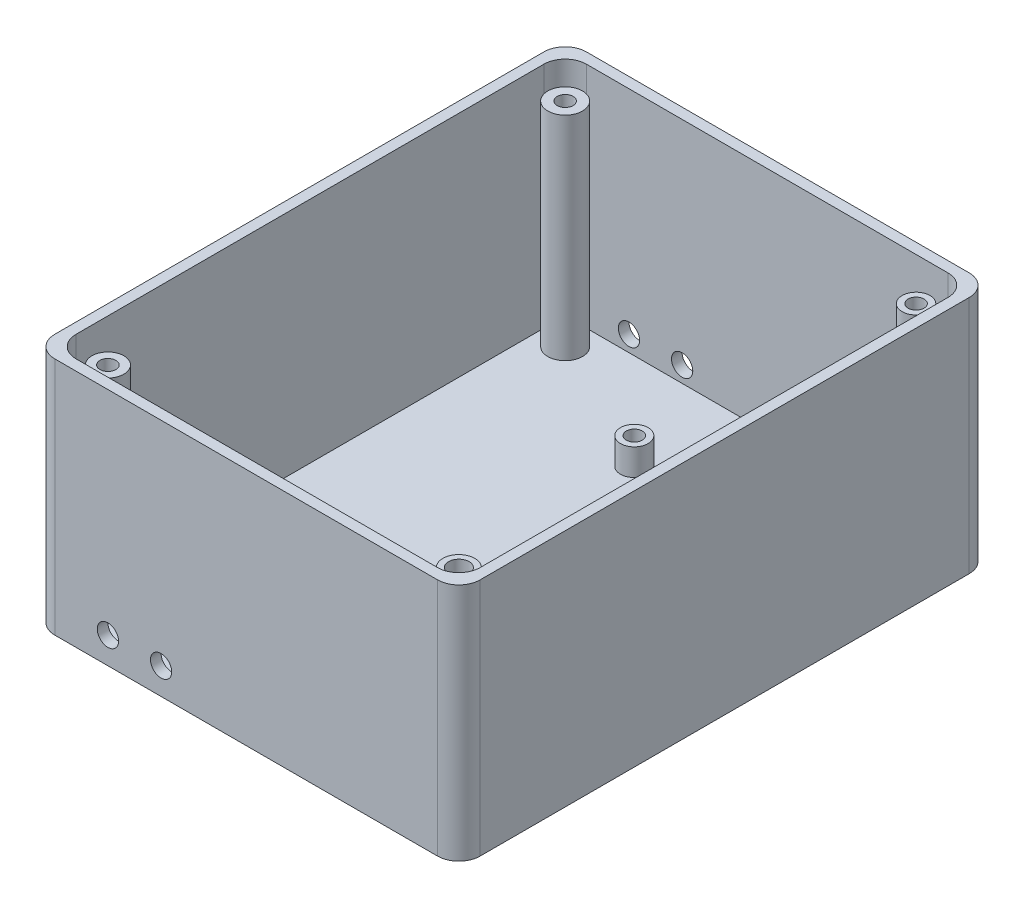
from build123d import *

# Parameters (mm, degrees)
SKETCH1_W            = 80
SKETCH1_H            = 100
BOSS_EXTRUDE1_DEPTH  = 45
SHELL1_T             = -2
FILLET1_R            = 4
FILLET2_R            = 4
FILLET4_R            = 4
FILLET5_R            = 4
FILLET6_R            = 4
FILLET7_R            = 4
FILLET12_R           = 4
FILLET13_R           = 4
SKETCH33_R           = 2.6
BOSS_EXTRUDE9_DEPTH  = 5
SKETCH37_R           = 2.624374832
SKETCH37_R_2         = 3
SKETCH37_R_3         = 3.264262679
BOSS_EXTRUDE10_DEPTH = 40
SKETCH38_R           = 1.5
SKETCH38_R_2         = 1.938271083
CUT_EXTRUDE3_DEPTH   = 40
SKETCH39_R           = 1.5
CUT_EXTRUDE4_DEPTH   = 5
SKETCH40_R           = 2
CUT_EXTRUDE5_DEPTH   = 10
CUT_EXTRUDE6_START   = -10
SKETCH41_R           = 2
CUT_EXTRUDE6_DEPTH   = 10


with BuildPart() as part:
    # Sketch1 → Boss-Extrude1 (new body)
    with BuildSketch(Plane(origin=(0, 0, 0), x_dir=(1, 0, 0), z_dir=(0, 1, 0))):
        Rectangle(SKETCH1_W, SKETCH1_H)
    extrude(amount=BOSS_EXTRUDE1_DEPTH)

    # Shell1
    shell1_openings = [part.faces().sort_by_distance(p)[0] for p in [
        (0, 45, 0),
    ]]
    offset(amount=SHELL1_T, openings=shell1_openings, kind=Kind.INTERSECTION)

    # Fillet1
    fillet1_edges = [part.edges().sort_by_distance(p)[0] for p in [
        (-40, 22.5, 50),
    ]]
    fillet(fillet1_edges, radius=FILLET1_R)

    # Fillet2
    fillet2_edges = [part.edges().sort_by_distance(p)[0] for p in [
        (-38, 23.5, 48),
    ]]
    fillet(fillet2_edges, radius=FILLET2_R)

    # Fillet4
    fillet4_edges = [part.edges().sort_by_distance(p)[0] for p in [
        (-38, 23.5, -48),
    ]]
    fillet(fillet4_edges, radius=FILLET4_R)

    # Fillet5
    fillet5_edges = [part.edges().sort_by_distance(p)[0] for p in [
        (-40, 22.5, -50),
    ]]
    fillet(fillet5_edges, radius=FILLET5_R)

    # Fillet6
    fillet6_edges = [part.edges().sort_by_distance(p)[0] for p in [
        (38, 23.5, 48),
    ]]
    fillet(fillet6_edges, radius=FILLET6_R)

    # Fillet7
    fillet7_edges = [part.edges().sort_by_distance(p)[0] for p in [
        (40, 22.5, 50),
    ]]
    fillet(fillet7_edges, radius=FILLET7_R)

    # Fillet12
    fillet12_edges = [part.edges().sort_by_distance(p)[0] for p in [
        (40, 22.5, -50),
    ]]
    fillet(fillet12_edges, radius=FILLET12_R)

    # Fillet13
    fillet13_edges = [part.edges().sort_by_distance(p)[0] for p in [
        (38, 23.5, -48),
    ]]
    fillet(fillet13_edges, radius=FILLET13_R)

    # Sketch33 → Boss-Extrude9 (add)
    with BuildSketch(Plane(origin=(0, 2, 0), x_dir=(1, 0, 0), z_dir=(0, 1, 0))):
        with Locations(Location((28, 30, 0), (0, 0, 270))):
            Circle(SKETCH33_R)
        with Locations(Location((28, -30, 0), (0, 0, 270))):
            Circle(SKETCH33_R)
        with Locations(Location((-7, 30, 0), (0, 0, 270))):
            Circle(SKETCH33_R)
        with Locations(Location((-7, -30, 0), (0, 0, 270))):
            Circle(SKETCH33_R)
    extrude(amount=BOSS_EXTRUDE9_DEPTH)

    # Sketch37 → Boss-Extrude10 (add)
    with BuildSketch(Plane(origin=(0, 2, 0), x_dir=(1, 0, 0), z_dir=(0, 1, 0))):
        with Locations(Location((33, 43, 0), (0, 0, 270))):
            Circle(SKETCH37_R)
        with Locations(Location((33, -43, 0), (0, 0, 270))):
            Circle(SKETCH37_R_2)
        with Locations(Location((-33, 43, 0), (0, 0, 270))):
            Circle(SKETCH37_R_3)
        with Locations(Location((-33, -43, 0), (0, 0, 270))):
            Circle(SKETCH37_R_2)
    extrude(amount=BOSS_EXTRUDE10_DEPTH)

    # Sketch38 → Cut-Extrude3 (cut)
    with BuildSketch(Plane(origin=(0, 42, 0), x_dir=(1, 0, 0), z_dir=(0, 1, 0))):
        with Locations(Location((33, 43, 0), (0, 0, 270))):
            Circle(SKETCH38_R)
        with Locations(Location((33, -43, 0), (0, 0, 270))):
            Circle(SKETCH38_R_2)
        with Locations(Location((-33, 43, 0), (0, 0, 270))):
            Circle(SKETCH38_R)
        with Locations(Location((-33, -43, 0), (0, 0, 270))):
            Circle(SKETCH38_R)
    extrude(amount=-CUT_EXTRUDE3_DEPTH, mode=Mode.SUBTRACT)

    # Sketch39 → Cut-Extrude4 (cut)
    with BuildSketch(Plane(origin=(0, 7, 0), x_dir=(1, 0, 0), z_dir=(0, 1, 0))):
        with Locations(Location((28, 30, 0), (0, 0, 270))):
            Circle(SKETCH39_R)
        with Locations(Location((28, -30, 0), (0, 0, 270))):
            Circle(SKETCH39_R)
        with Locations(Location((-7, 30, 0), (0, 0, 270))):
            Circle(SKETCH39_R)
        with Locations(Location((-7, -30, 0), (0, 0, 270))):
            Circle(SKETCH39_R)
    extrude(amount=-CUT_EXTRUDE4_DEPTH, mode=Mode.SUBTRACT)

    # Sketch40 → Cut-Extrude5 (cut)
    with BuildSketch(Plane.XY.offset(50)):
        with Locations((-26, 5)):
            Circle(SKETCH40_R)
        with Locations((-16, 5)):
            Circle(SKETCH40_R)
    extrude(amount=-CUT_EXTRUDE5_DEPTH, mode=Mode.SUBTRACT)

    # Sketch41 → Cut-Extrude6 (cut)
    with BuildSketch(Plane(origin=(0, 0, -50), x_dir=(-1, 0, 0), z_dir=(0, 0, -1)).offset(CUT_EXTRUDE6_START)):
        with Locations(Location((26, 5, 0), (0, 0, 180))):
            Circle(SKETCH41_R)
        with Locations(Location((16, 5, 0), (0, 0, 180))):
            Circle(SKETCH41_R)
    extrude(amount=CUT_EXTRUDE6_DEPTH, mode=Mode.SUBTRACT)


solid = part.part
